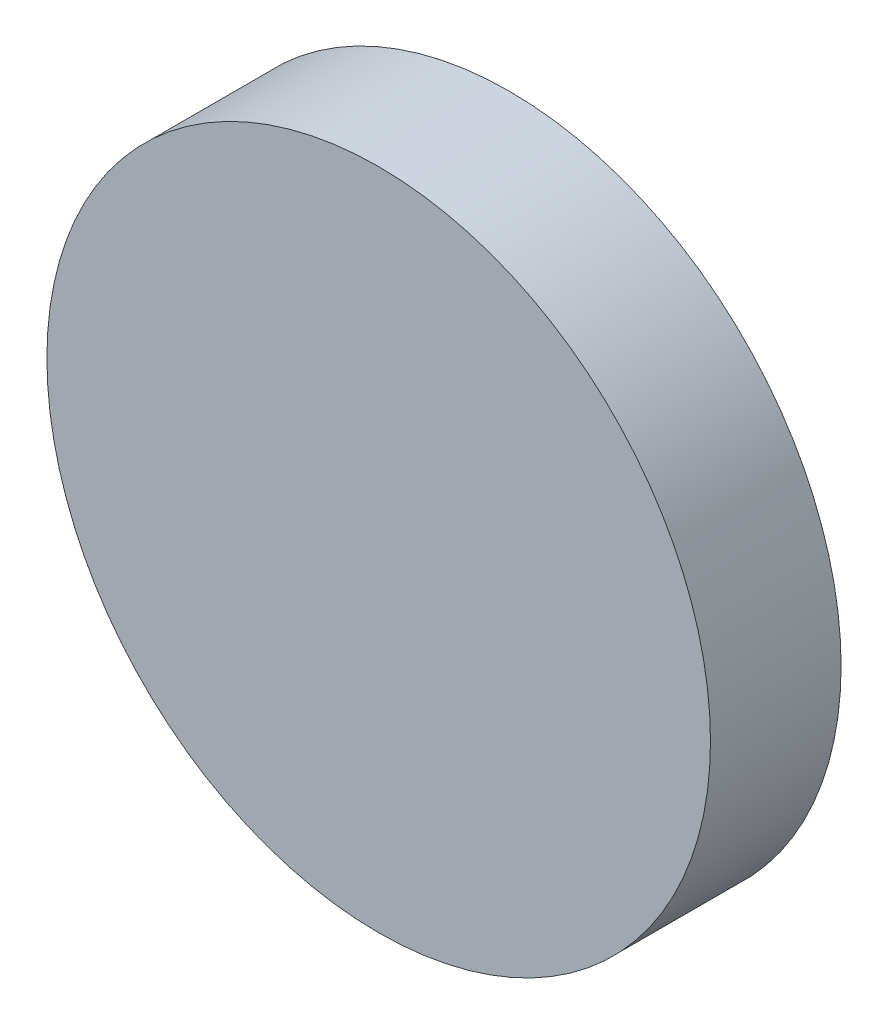
from build123d import *

# Parameters (mm, degrees)
SKIZZE1_R                       = 12.7
AUFSATZ_LINEAR_AUSTRAGEN1_DEPTH = 5
SKIZZE2_R                       = 6
AUFSATZ_LINEAR_AUSTRAGEN3_DEPTH = 4.2


with BuildPart() as part:
    # Skizze1 → Aufsatz-Linear austragen1 (new body)
    with BuildSketch(Plane(origin=(0, 0, 0), x_dir=(0, 1, 0), z_dir=(0, 0, 1))):
        with Locations(Location((0, 0, 0), (0, 0, 270))):
            Circle(SKIZZE1_R)
    extrude(amount=AUFSATZ_LINEAR_AUSTRAGEN1_DEPTH)

    # Skizze2 → Aufsatz-Linear austragen3 (add)
    with BuildSketch(Plane(origin=(0, 0, 0), x_dir=(0, 1, 0), z_dir=(0, 0, 1))):
        with Locations(Location((0, 0, 0), (0, 0, 270))):
            Circle(SKIZZE2_R)
    extrude(amount=-AUFSATZ_LINEAR_AUSTRAGEN3_DEPTH)


solid = part.part
